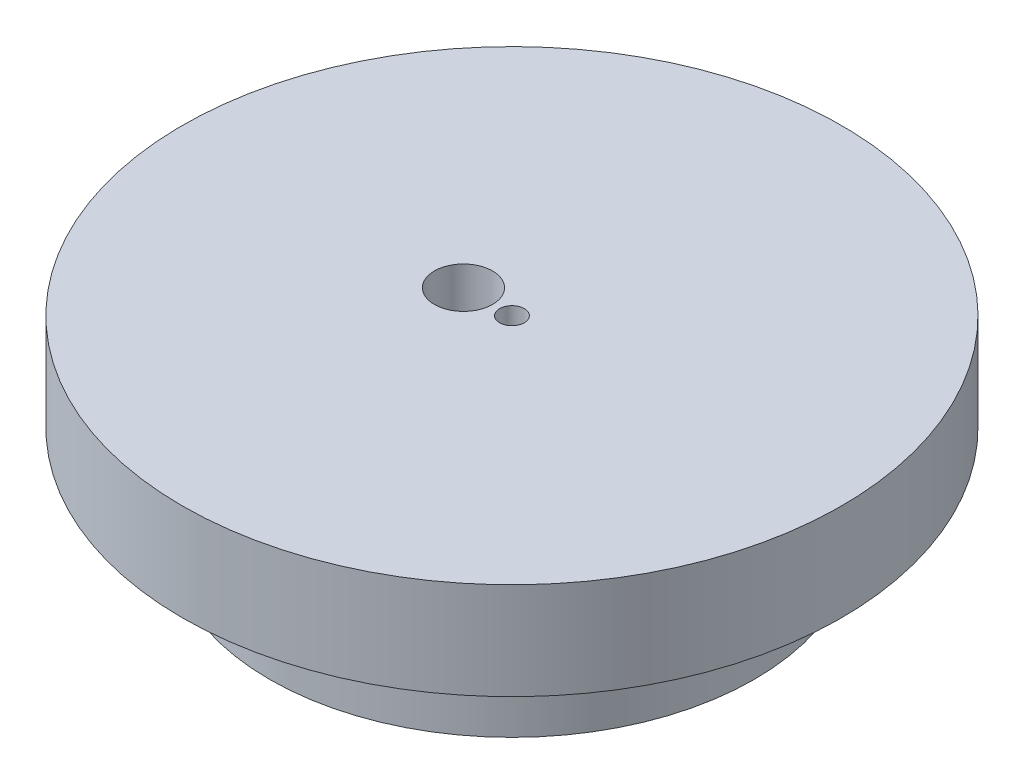
from build123d import *

# Parameters (mm, degrees)
SKETCH1_R           = 25
BOSS_EXTRUDE1_DEPTH = 10
SKETCH2_R           = 34
SKETCH2_R_2         = 1.27
BOSS_EXTRUDE2_DEPTH = 10
SKETCH3_R           = 3
CUT_EXTRUDE1_DEPTH  = 53.076866265


with BuildPart() as part:
    # Sketch1 → Boss-Extrude1 (new body)
    with BuildSketch(Plane(origin=(0, 0, 0), x_dir=(1, 0, 0), z_dir=(0, 1, 0))):
        with Locations(Location((0, 0, 0), (0, 0, 270))):
            Circle(SKETCH1_R)
        with BuildLine():
            Line((-1.5, 11), (1.5, 11))
            Line((1.5, 11), (2.425924848, 8.146464793))
            ThreePointArc((2.425924848, 8.146464793), (3.252809175, 7.852976026), (4.045032587, 7.475808409))
            Line((4.045032587, 7.475808409), (6.717514421, 8.838834765))
            Line((6.717514421, 8.838834765), (8.838834765, 6.717514421))
            Line((8.838834765, 6.717514421), (7.475808409, 4.045032587))
            ThreePointArc((7.475808409, 4.045032587), (7.852976026, 3.252809175), (8.146464793, 2.425924848))
            Line((8.146464793, 2.425924848), (11, 1.5))
            Line((11, 1.5), (11, -1.5))
            Line((11, -1.5), (8.146464793, -2.425924848))
            ThreePointArc((8.146464793, -2.425924848), (7.852976026, -3.252809175), (7.475808409, -4.045032587))
            Line((7.475808409, -4.045032587), (8.838834765, -6.717514421))
            Line((8.838834765, -6.717514421), (6.717514421, -8.838834765))
            Line((6.717514421, -8.838834765), (4.045032587, -7.475808409))
            ThreePointArc((4.045032587, -7.475808409), (3.252809175, -7.852976026), (2.425924848, -8.146464793))
            Line((2.425924848, -8.146464793), (1.5, -11))
            Line((1.5, -11), (-1.5, -11))
            Line((-1.5, -11), (-2.425924848, -8.146464793))
            ThreePointArc((-2.425924848, -8.146464793), (-3.252809175, -7.852976026), (-4.045032587, -7.475808409))
            Line((-4.045032587, -7.475808409), (-6.717514421, -8.838834765))
            Line((-6.717514421, -8.838834765), (-8.838834765, -6.717514421))
            Line((-8.838834765, -6.717514421), (-7.475808409, -4.045032587))
            ThreePointArc((-7.475808409, -4.045032587), (-7.852976026, -3.252809175), (-8.146464793, -2.425924848))
            Line((-8.146464793, -2.425924848), (-11, -1.5))
            Line((-11, -1.5), (-11, 1.5))
            Line((-11, 1.5), (-8.146464793, 2.425924848))
            ThreePointArc((-8.146464793, 2.425924848), (-7.852976026, 3.252809175), (-7.475808409, 4.045032587))
            Line((-7.475808409, 4.045032587), (-8.838834765, 6.717514421))
            Line((-8.838834765, 6.717514421), (-6.717514421, 8.838834765))
            Line((-6.717514421, 8.838834765), (-4.045032587, 7.475808409))
            ThreePointArc((-4.045032587, 7.475808409), (-3.252809175, 7.852976026), (-2.425924848, 8.146464793))
            Line((-2.425924848, 8.146464793), (-1.5, 11))
        make_face(mode=Mode.SUBTRACT)
    extrude(amount=BOSS_EXTRUDE1_DEPTH)

    # Sketch2 → Boss-Extrude2 (add)
    with BuildSketch(Plane(origin=(0, 10, 0), x_dir=(1, 0, 0), z_dir=(0, 1, 0))):
        with Locations(Location((0, 0, 0), (0, 0, 270))):
            Circle(SKETCH2_R)
        with Locations(Location((0, 0, 0), (0, 0, 270))):
            Circle(SKETCH2_R_2, mode=Mode.SUBTRACT)
    extrude(amount=BOSS_EXTRUDE2_DEPTH)

    # Sketch3 → Cut-Extrude1 (cut, through all)
    with BuildSketch(Plane(origin=(0, 20, 0), x_dir=(1, 0, 0), z_dir=(0, 1, 0))):
        with Locations(Location((-5, 0, 0), (0, 0, 270))):
            Circle(SKETCH3_R)
    extrude(amount=-CUT_EXTRUDE1_DEPTH, mode=Mode.SUBTRACT)


solid = part.part
